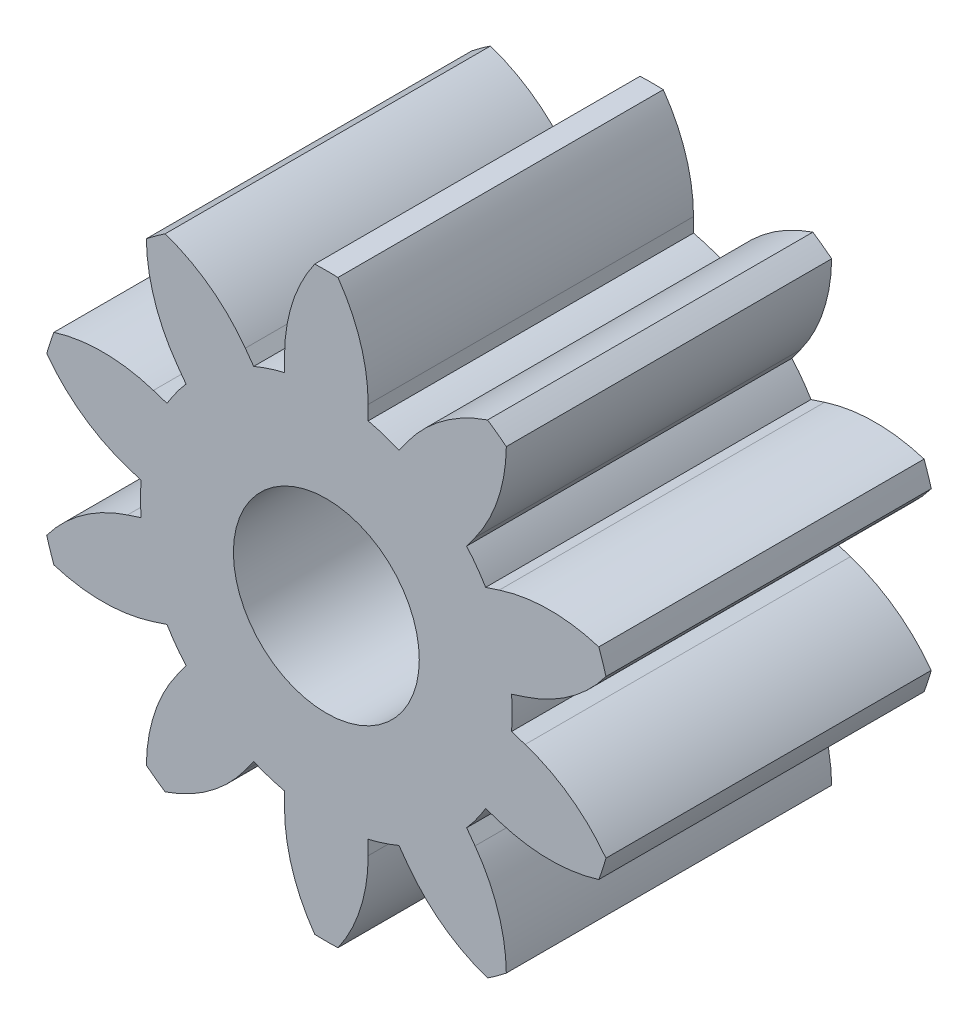
from build123d import *

# Parameters (mm, degrees)
ESBO_O1_R                = 2
RESSALTO_EXTRUS_O1_DEPTH = 3.5
ESBO_O2_R                = 1
CORTE_EXTRUS_O1_DEPTH    = 6.573642863


with BuildPart() as part:
    # Esboço1 → Ressalto-extrusão1 (new body)
    with BuildSketch(Plane.XY):
        Circle(ESBO_O1_R)
        with BuildLine():
            ThreePointArc((-1.509485071, 1.312042233), (-1.175570505, 1.618033989), (-0.781369776, 1.84104896))
            Line((-0.781369776, 1.84104896), (-0.871690079, 1.965364192))
            ThreePointArc((-0.871690079, 1.965364192), (-1.253664041, 2.349535361), (-1.734231738, 2.599627912))
            ThreePointArc((-1.734231738, 2.599627912), (-1.836828913, 2.528178107), (-1.936485986, 2.452681599))
            ThreePointArc((-1.936485986, 2.452681599), (-1.847137421, 1.918351711), (-1.599805374, 1.436357465))
            Line((-1.599805374, 1.436357465), (-1.509485071, 1.312042233))
        make_face()
        with BuildLine():
            ThreePointArc((-0.45, 1.948717527), (0, 2), (0.45, 1.948717527))
            Line((0.45, 1.948717527), (0.45, 2.102379604))
            ThreePointArc((0.45, 2.102379604), (0.36678672, 2.63769927), (0.125, 3.122498999))
            ThreePointArc((0.125, 3.122498999), (0, 3.125), (-0.125, 3.122498999))
            ThreePointArc((-0.125, 3.122498999), (-0.36678672, 2.63769927), (-0.45, 2.102379604))
            Line((-0.45, 2.102379604), (-0.45, 1.948717527))
        make_face()
        with BuildLine():
            Line((0.871690079, 1.965364192), (0.781369776, 1.84104896))
            ThreePointArc((0.781369776, 1.84104896), (1.175570505, 1.618033989), (1.509485071, 1.312042233))
            Line((1.509485071, 1.312042233), (1.599805374, 1.436357465))
            ThreePointArc((1.599805374, 1.436357465), (1.847137421, 1.918351711), (1.936485986, 2.452681599))
            ThreePointArc((1.936485986, 2.452681599), (1.836828913, 2.528178107), (1.734231738, 2.599627912))
            ThreePointArc((1.734231738, 2.599627912), (1.253664041, 2.349535361), (0.871690079, 1.965364192))
        make_face()
        with BuildLine():
            Line((1.860424175, 1.077646459), (1.714282855, 1.030162265))
            ThreePointArc((1.714282855, 1.030162265), (1.902113033, 0.618033989), (1.99239815, 0.174211401))
            Line((1.99239815, 0.174211401), (2.13853947, 0.221695594))
            ThreePointArc((2.13853947, 0.221695594), (2.621944409, 0.466259001), (3.008300145, 0.846023191))
            ThreePointArc((3.008300145, 0.846023191), (2.972051613, 0.965678107), (2.931045896, 1.08378732))
            ThreePointArc((2.931045896, 1.08378732), (2.395257749, 1.163928801), (1.860424175, 1.077646459))
        make_face()
        with BuildLine():
            Line((2.13853947, -0.221695594), (1.99239815, -0.174211401))
            ThreePointArc((1.99239815, -0.174211401), (1.902113033, -0.618033989), (1.714282855, -1.030162265))
            Line((1.714282855, -1.030162265), (1.860424175, -1.077646459))
            ThreePointArc((1.860424175, -1.077646459), (2.395257749, -1.163928801), (2.931045896, -1.08378732))
            ThreePointArc((2.931045896, -1.08378732), (2.972051613, -0.965678107), (3.008300145, -0.846023191))
            ThreePointArc((3.008300145, -0.846023191), (2.621944409, -0.466259001), (2.13853947, -0.221695594))
        make_face()
        with BuildLine():
            Line((1.599805374, -1.436357465), (1.509485071, -1.312042233))
            ThreePointArc((1.509485071, -1.312042233), (1.175570505, -1.618033989), (0.781369776, -1.84104896))
            Line((0.781369776, -1.84104896), (0.871690079, -1.965364192))
            ThreePointArc((0.871690079, -1.965364192), (1.253664041, -2.349535361), (1.734231738, -2.599627912))
            ThreePointArc((1.734231738, -2.599627912), (1.836828913, -2.528178107), (1.936485986, -2.452681599))
            ThreePointArc((1.936485986, -2.452681599), (1.847137421, -1.918351711), (1.599805374, -1.436357465))
        make_face()
        with BuildLine():
            Line((0.45, -2.102379604), (0.45, -1.948717527))
            ThreePointArc((0.45, -1.948717527), (0, -2), (-0.45, -1.948717527))
            Line((-0.45, -1.948717527), (-0.45, -2.102379604))
            ThreePointArc((-0.45, -2.102379604), (-0.36678672, -2.63769927), (-0.125, -3.122498999))
            ThreePointArc((-0.125, -3.122498999), (0, -3.125), (0.125, -3.122498999))
            ThreePointArc((0.125, -3.122498999), (0.36678672, -2.63769927), (0.45, -2.102379604))
        make_face()
        with BuildLine():
            ThreePointArc((-0.781369776, -1.84104896), (-1.175570505, -1.618033989), (-1.509485071, -1.312042233))
            Line((-1.509485071, -1.312042233), (-1.599805374, -1.436357465))
            ThreePointArc((-1.599805374, -1.436357465), (-1.847137421, -1.918351711), (-1.936485986, -2.452681599))
            ThreePointArc((-1.936485986, -2.452681599), (-1.836828913, -2.528178107), (-1.734231738, -2.599627912))
            ThreePointArc((-1.734231738, -2.599627912), (-1.253664041, -2.349535361), (-0.871690079, -1.965364192))
            Line((-0.871690079, -1.965364192), (-0.781369776, -1.84104896))
        make_face()
        with BuildLine():
            ThreePointArc((-1.714282855, -1.030162265), (-1.902113033, -0.618033989), (-1.99239815, -0.174211401))
            Line((-1.99239815, -0.174211401), (-2.13853947, -0.221695594))
            ThreePointArc((-2.13853947, -0.221695594), (-2.621944409, -0.466259001), (-3.008300145, -0.846023191))
            ThreePointArc((-3.008300145, -0.846023191), (-2.972051613, -0.965678107), (-2.931045896, -1.08378732))
            ThreePointArc((-2.931045896, -1.08378732), (-2.395257749, -1.163928801), (-1.860424175, -1.077646459))
            Line((-1.860424175, -1.077646459), (-1.714282855, -1.030162265))
        make_face()
        with BuildLine():
            ThreePointArc((-1.99239815, 0.174211401), (-1.902113033, 0.618033989), (-1.714282855, 1.030162265))
            Line((-1.714282855, 1.030162265), (-1.860424175, 1.077646459))
            ThreePointArc((-1.860424175, 1.077646459), (-2.395257749, 1.163928801), (-2.931045896, 1.08378732))
            ThreePointArc((-2.931045896, 1.08378732), (-2.972051613, 0.965678107), (-3.008300145, 0.846023191))
            ThreePointArc((-3.008300145, 0.846023191), (-2.621944409, 0.466259001), (-2.13853947, 0.221695594))
            Line((-2.13853947, 0.221695594), (-1.99239815, 0.174211401))
        make_face()
    extrude(amount=RESSALTO_EXTRUS_O1_DEPTH)

    # Esboço2 → Corte-extrusão1 (cut, through all)
    with BuildSketch(Plane.XY.offset(3.5)):
        Circle(ESBO_O2_R)
    extrude(amount=-CORTE_EXTRUS_O1_DEPTH, mode=Mode.SUBTRACT)


solid = part.part
